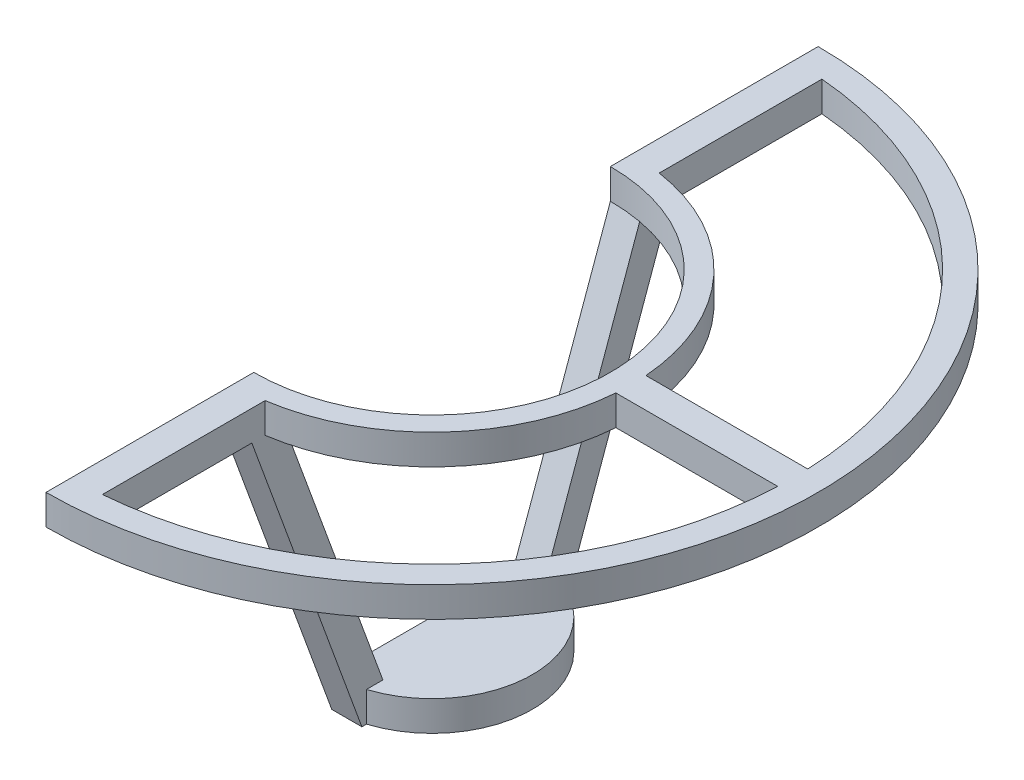
from build123d import *

# Parameters (mm, degrees)
BOSS_EXTRUDE2_DEPTH = 3
BOSS_EXTRUDE3_DEPTH = 3
BOSS_EXTRUDE4_DEPTH = 3


with BuildPart() as part:
    # Sketch1 → Boss-Extrude2 (new body)
    with BuildSketch(Plane(origin=(0, 0, 0), x_dir=(1, 0, 0), z_dir=(0, 1, 0))):
        with BuildLine():
            Line((0, -17.78), (0, -38.5))
            ThreePointArc((0, -38.5), (38.5, 0), (0, 38.5))
            Line((0, 38.5), (0, 17.78))
            ThreePointArc((0, 17.78), (17.78, 0), (0, -17.78))
        make_face()
        with BuildLine():
            Line((3, 35.874782229), (3, 19.652338283))
            ThreePointArc((3, 19.652338283), (14.580910151, 13.513380746), (19.82332969, 1.5))
            Line((19.82332969, 1.5), (35.968736425, 1.5))
            ThreePointArc((35.968736425, 1.5), (25.981666959, 24.918928188), (3, 35.874782229))
        make_face(mode=Mode.SUBTRACT)
        with BuildLine():
            Line((3, -19.652338283), (3, -35.874782229))
            ThreePointArc((3, -35.874782229), (25.981666959, -24.918928188), (35.968736425, -1.5))
            Line((35.968736425, -1.5), (19.82332969, -1.5))
            ThreePointArc((19.82332969, -1.5), (14.580910151, -13.513380746), (3, -19.652338283))
        make_face(mode=Mode.SUBTRACT)
    extrude(amount=BOSS_EXTRUDE2_DEPTH)



with BuildPart() as body_2:
    # Sketch4 → Boss-Extrude3 (new body)
    with BuildSketch(Plane(origin=(0, -30, 0), x_dir=(-1, 0, 0), z_dir=(0, -1, 0))):
        with BuildLine():
            Line((0, 10), (0, -10))
            ThreePointArc((0, -10), (-10, 0), (0, 10))
        make_face()
    extrude(amount=-BOSS_EXTRUDE3_DEPTH)


with BuildPart() as part_1:
    add(part.part)

    add(body_2.part)  # Boss-Extrude4 merges body 2
    # Sketch6 → Boss-Extrude4 (add)
    with BuildSketch(Plane(origin=(0, 0, 0), x_dir=(0, 0, -1), z_dir=(1, 0, 0))):
        Polygon((20.78, 0), (10, -30), (8.078, -30), (8.078, -27), (17.78, 0), align=None)
        Polygon((-20.974429694, 0), (-10, -30), (-7.903013275, -30), (-7.903013275, -27), (-17.78, 0), align=None)
    extrude(amount=BOSS_EXTRUDE4_DEPTH)


solid = part_1.part
